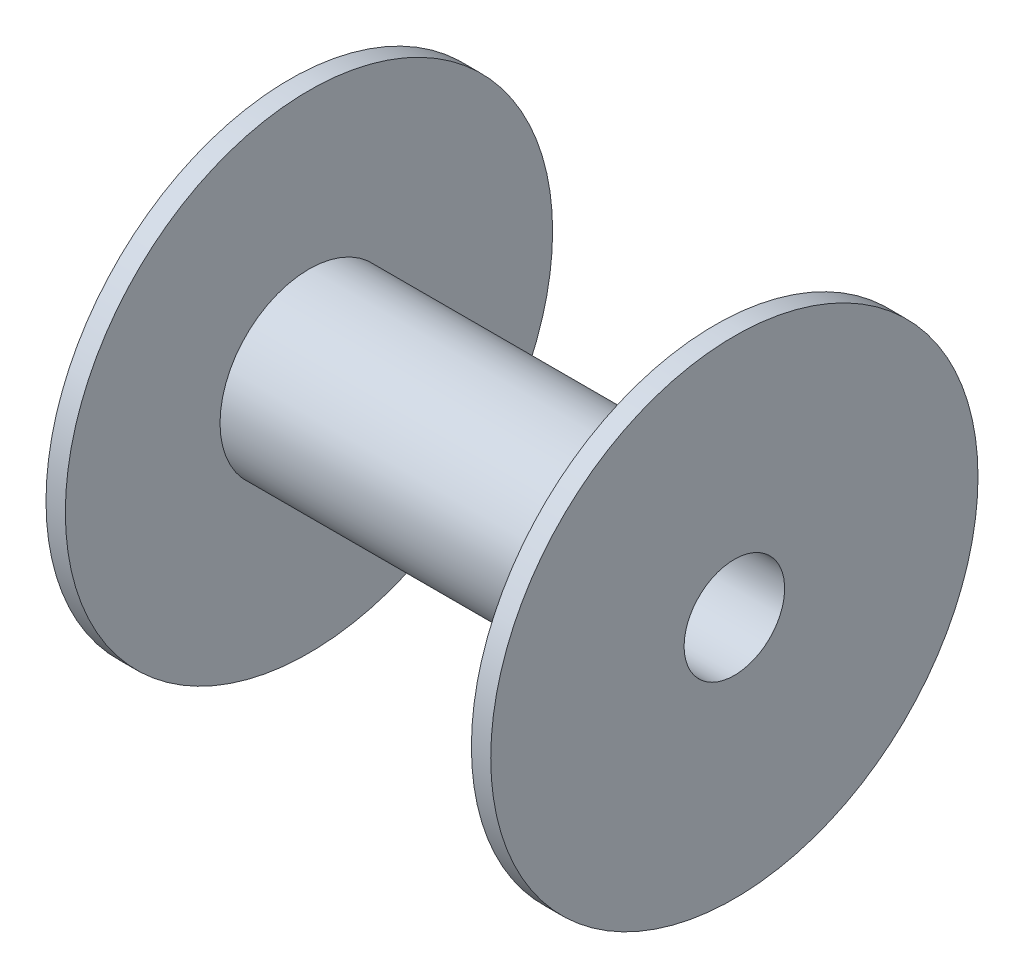
from build123d import *


with BuildPart() as part:
    # Sketch1 → Revolve1 (revolve)
    with BuildSketch(Plane.XY, mode=Mode.PRIVATE) as revolve1_sk:
        Polygon((-57.5, 63), (-52.5, 63), (-52.5, 23), (52.5, 23), (52.5, 63), (57.5, 63), (57.5, 13), (-57.5, 13), align=None)
    revolve(revolve1_sk.sketch.rotate(Axis((-70, 0, 0), (1, 0, 0)), 90), axis=Axis((-70, 0, 0), (1, 0, 0)))


solid = part.part
